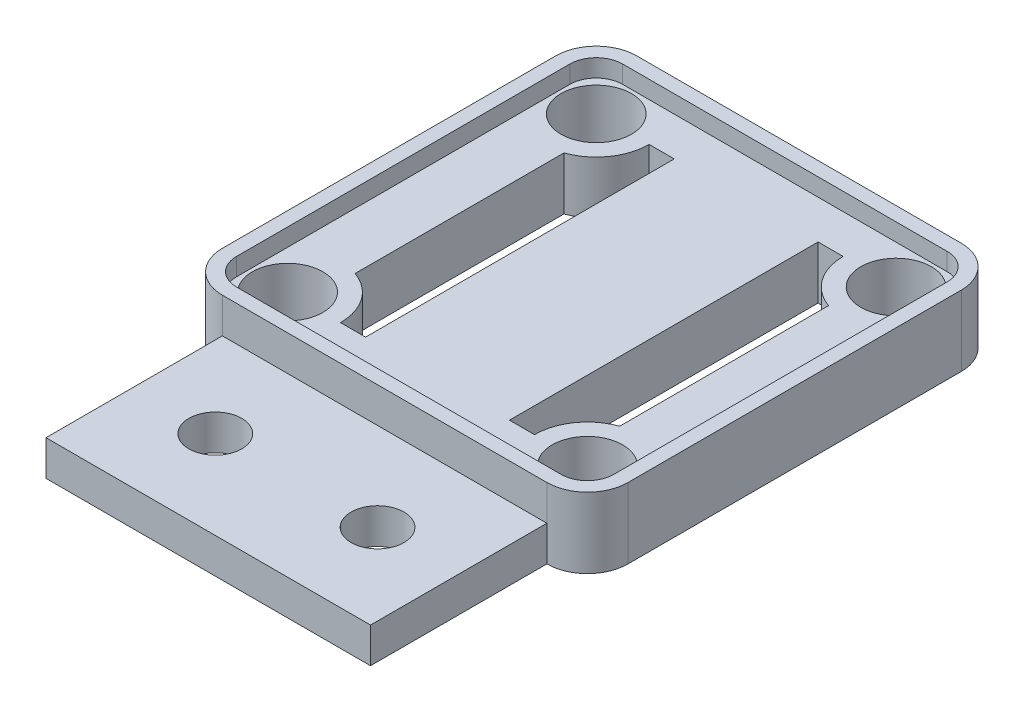
from build123d import *

# Parameters (mm, degrees)
BOSS_EXTRUDE1_DEPTH = 4
CUT_EXTRUDE2_DEPTH  = 1
SKETCH5_R           = 2
CUT_EXTRUDE3_DEPTH  = 22.132971525
CUT_EXTRUDE4_DEPTH  = 22.132971525
SKETCH7_W           = 18.4
SKETCH7_H           = 2
BOSS_EXTRUDE2_DEPTH = 10
SKETCH8_R           = 1.5
CUT_EXTRUDE5_DEPTH  = 25.154392176
CUT_EXTRUDE6_DEPTH  = 1
SKETCH11_W          = 1.421057218
SKETCH11_H          = 17.5
CUT_EXTRUDE7_DEPTH  = 25.257672217


with BuildPart() as part:
    # Sketch1 → Boss-Extrude1 (new body)
    with BuildSketch(Plane(origin=(0, 0, 0), x_dir=(1, 0, 0), z_dir=(0, 1, 0))):
        with BuildLine():
            Line((-12.649074074, 14.633101852), (5.750925926, 14.633101852))
            ThreePointArc((5.750925926, 14.633101852), (7.377271523, 13.959447449), (8.050925926, 12.333101852))
            Line((8.050925926, 12.333101852), (8.050925926, -6.566898148))
            ThreePointArc((8.050925926, -6.566898148), (7.377271523, -8.193243745), (5.750925926, -8.866898148))
            Line((5.750925926, -8.866898148), (-12.649074074, -8.866898148))
            ThreePointArc((-12.649074074, -8.866898148), (-14.275419671, -8.193243745), (-14.949074074, -6.566898148))
            Line((-14.949074074, -6.566898148), (-14.949074074, 12.333101852))
            ThreePointArc((-14.949074074, 12.333101852), (-14.275419671, 13.959447449), (-12.649074074, 14.633101852))
        make_face()
    extrude(amount=BOSS_EXTRUDE1_DEPTH)

    # Sketch2 → Cut-Extrude2 (cut)
    with BuildSketch(Plane(origin=(0, 4, 0), x_dir=(1, 0, 0), z_dir=(0, 1, 0))):
        with BuildLine():
            Line((5.750925926, 13.633101852), (-12.649074074, 13.633101852))
            ThreePointArc((-12.649074074, 13.633101852), (-13.56831289, 13.252340667), (-13.949074074, 12.333101852))
            Line((-13.949074074, 12.333101852), (-13.949074074, -6.566898148))
            ThreePointArc((-13.949074074, -6.566898148), (-13.56831289, -7.486136964), (-12.649074074, -7.866898148))
            Line((-12.649074074, -7.866898148), (5.750925926, -7.866898148))
            ThreePointArc((5.750925926, -7.866898148), (6.670164741, -7.486136964), (7.050925926, -6.566898148))
            Line((7.050925926, -6.566898148), (7.050925926, 12.333101852))
            ThreePointArc((7.050925926, 12.333101852), (6.670164741, 13.252340667), (5.750925926, 13.633101852))
        make_face()
    extrude(amount=-CUT_EXTRUDE2_DEPTH, mode=Mode.SUBTRACT)

    # Sketch5 → Cut-Extrude3 (cut, through all)
    with BuildSketch(Plane(origin=(0, 3, 0), x_dir=(1, 0, 0), z_dir=(0, 1, 0))):
        with Locations(Location((5.050925926, 11.633101852, 0), (0, 0, 270))):
            Circle(SKETCH5_R)
        with Locations(Location((5.050925926, -5.866898148, 0), (0, 0, 270))):
            Circle(SKETCH5_R)
        with Locations(Location((-11.949074074, -5.866898148, 0), (0, 0, 270))):
            Circle(SKETCH5_R)
        with Locations(Location((-11.949074074, 11.633101852, 0), (0, 0, 90))):
            Circle(SKETCH5_R)
    extrude(amount=-CUT_EXTRUDE3_DEPTH, mode=Mode.SUBTRACT)

    # Sketch6 → Cut-Extrude4 (cut, through all)
    with BuildSketch(Plane(origin=(0, 3, 0), x_dir=(1, 0, 0), z_dir=(0, 1, 0))):
        with BuildLine():
            Line((4.050925926, -3.038471023), (4.050925926, 8.804674727))
            ThreePointArc((4.050925926, 8.804674727), (2.601436183, 9.901051044), (2.050925926, 11.633101852))
            Line((2.050925926, 11.633101852), (2.050925926, -5.866898148))
            ThreePointArc((2.050925926, -5.866898148), (2.601436183, -4.134847341), (4.050925926, -3.038471023))
        make_face()
        with BuildLine():
            Line((-10.949074074, 8.804674727), (-10.949074074, -3.038471023))
            ThreePointArc((-10.949074074, -3.038471023), (-9.499584331, -4.134847341), (-8.949074074, -5.866898148))
            Line((-8.949074074, -5.866898148), (-8.949074074, 11.633101852))
            ThreePointArc((-8.949074074, 11.633101852), (-9.499584331, 9.901051044), (-10.949074074, 8.804674727))
        make_face()
    extrude(amount=-CUT_EXTRUDE4_DEPTH, mode=Mode.SUBTRACT)

    # Sketch7 → Boss-Extrude2 (add)
    with BuildSketch(Plane.XY.offset(8.866898148)):
        with Locations((-3.449074074, 1)):
            Rectangle(SKETCH7_W, SKETCH7_H)
    extrude(amount=BOSS_EXTRUDE2_DEPTH)

    # Sketch8 → Cut-Extrude5 (cut, through all)
    with BuildSketch(Plane(origin=(0, 2, 0), x_dir=(1, 0, 0), z_dir=(0, 1, 0))):
        with Locations(Location((1.150925926, -13.866898148, 0), (0, 0, 270))):
            Circle(SKETCH8_R)
        with Locations(Location((-8.049074074, -13.866898148, 0), (0, 0, 270))):
            Circle(SKETCH8_R)
    extrude(amount=-CUT_EXTRUDE5_DEPTH, mode=Mode.SUBTRACT)

    # Sketch9 → Cut-Extrude6 (cut)
    with BuildSketch(Plane(origin=(0, 4, 0), x_dir=(1, 0, 0), z_dir=(0, 1, 0))):
        with BuildLine():
            Line((5.750925926, 13.833101852), (-12.649074074, 13.833101852))
            ThreePointArc((-12.649074074, 13.833101852), (-13.709734246, 13.393762024), (-14.149074074, 12.333101852))
            Line((-14.149074074, 12.333101852), (-14.149074074, -6.566898148))
            ThreePointArc((-14.149074074, -6.566898148), (-13.709734246, -7.62755832), (-12.649074074, -8.066898148))
            Line((-12.649074074, -8.066898148), (5.750925926, -8.066898148))
            ThreePointArc((5.750925926, -8.066898148), (6.811586098, -7.62755832), (7.250925926, -6.566898148))
            Line((7.250925926, -6.566898148), (7.250925926, 12.333101852))
            ThreePointArc((7.250925926, 12.333101852), (6.811586098, 13.393762024), (5.750925926, 13.833101852))
        make_face()
    extrude(amount=-CUT_EXTRUDE6_DEPTH, mode=Mode.SUBTRACT)

    # Sketch11 → Cut-Extrude7 (cut, through all)
    with BuildSketch(Plane(origin=(0, 3, 0), x_dir=(1, 0, 0), z_dir=(0, 1, 0))):
        with Locations((-8.238545465, 2.883101852)):
            Rectangle(SKETCH11_W, SKETCH11_H)
        with Locations((1.340397317, 2.883101852)):
            Rectangle(SKETCH11_W, SKETCH11_H)
    extrude(amount=-CUT_EXTRUDE7_DEPTH, mode=Mode.SUBTRACT)


solid = part.part
